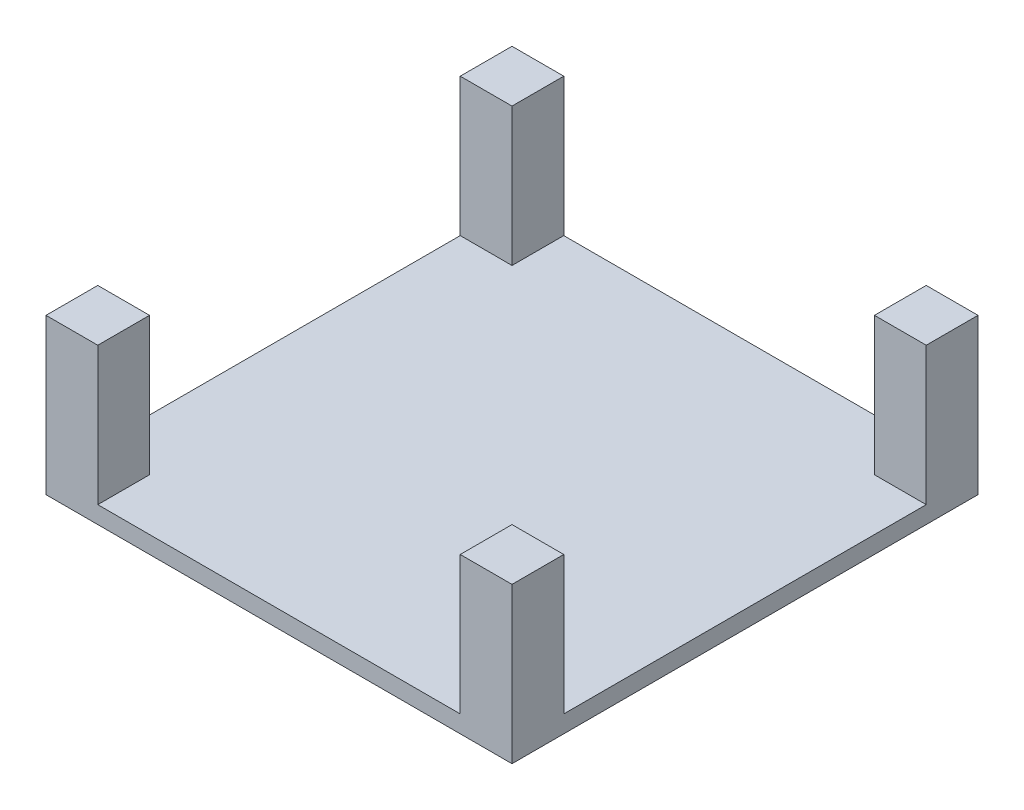
from build123d import *

# Parameters (mm, degrees)
SKETCH1_W           = 135
SKETCH1_H           = 135
BOSS_EXTRUDE1_DEPTH = 5
SKETCH2_W           = 15
SKETCH2_H           = 15
BOSS_EXTRUDE2_DEPTH = 40


with BuildPart() as part:
    # Sketch1 → Boss-Extrude1 (new body)
    with BuildSketch(Plane(origin=(0, 0, 0), x_dir=(1, 0, 0), z_dir=(0, 1, 0))):
        with Locations((67.5, 67.5)):
            Rectangle(SKETCH1_W, SKETCH1_H)
    extrude(amount=BOSS_EXTRUDE1_DEPTH)

    # Sketch2 → Boss-Extrude2 (add)
    with BuildSketch(Plane(origin=(0, 5, 0), x_dir=(1, 0, 0), z_dir=(0, 1, 0))):
        with Locations((7.5, 7.5)):
            Rectangle(SKETCH2_W, SKETCH2_H)
        with Locations((127.5, 7.5)):
            Rectangle(SKETCH2_W, SKETCH2_H)
        with Locations((127.5, 127.5)):
            Rectangle(SKETCH2_W, SKETCH2_H)
        with Locations((7.5, 127.5)):
            Rectangle(SKETCH2_W, SKETCH2_H)
    extrude(amount=BOSS_EXTRUDE2_DEPTH)


solid = part.part
